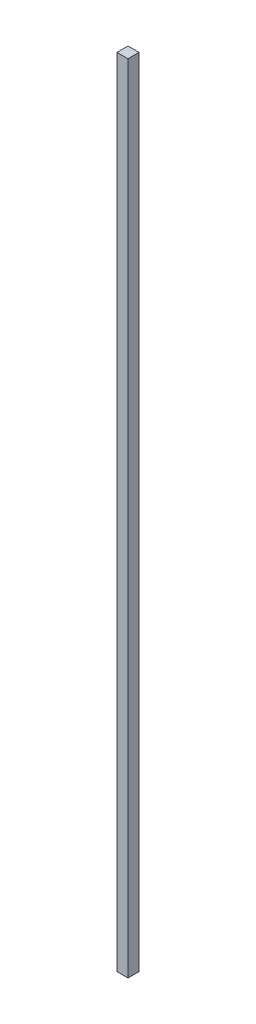
from build123d import *

# Parameters (mm, degrees)
SKETCH2_W           = 25.4
SKETCH2_H           = 25.4
BOSS_EXTRUDE1_DEPTH = 1828.8


with BuildPart() as part:
    # Sketch2 → Boss-Extrude1 (new body)
    with BuildSketch(Plane(origin=(0, 0, 0), x_dir=(1, 0, 0), z_dir=(0, 1, 0))):
        with Locations((-12.7, -12.7)):
            Rectangle(SKETCH2_W, SKETCH2_H)
    extrude(amount=BOSS_EXTRUDE1_DEPTH)


solid = part.part
